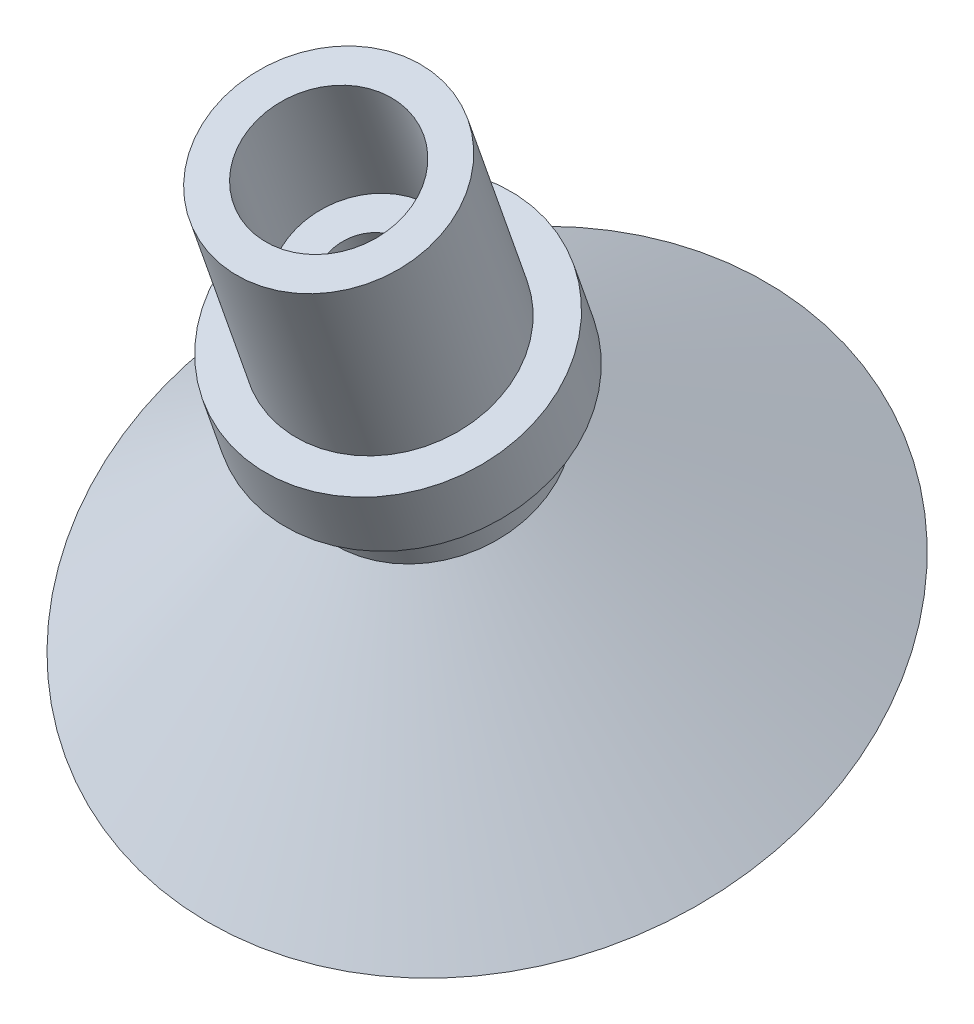
from build123d import *


with BuildPart() as part:
    # Inlet Fairlead Liner Profile → Inlet Fairlead Liner Feature (revolve)
    with BuildSketch(Plane(origin=(3.258206564, -5.512003586, 12.159792439), x_dir=(0.9714880974430896, 0.0978844603025642, -0.21593866943574935), z_dir=(0.2370883306415693, -0.40108928116054926, 0.8848256958360261)), mode=Mode.PRIVATE) as inlet_fairlead_liner_feature_sk:
        with BuildLine():
            Line((-23.152018399, -30.892753147), (-23.579443274, -34.869851081))
            Line((-23.579443274, -34.869851081), (-22.634882515, -34.971364489))
            Line((-22.634882515, -34.971364489), (-23.062307391, -38.948462423))
            add(Edge.make_bspline(
                [(-23.062307391, -38.948462423), (-23.13354487, -39.611312079), (-24.199056833, -40.167305516), (-24.270294312, -40.830155171)],
                knots=[0, 0, 0, 0, 1, 1, 1, 1], degree=3))
            ThreePointArc((-24.270294312, -40.830155171), (-26.470944377, -44.860719778), (-30.877078526, -46.154664759))
            Line((-30.877078526, -46.154664759), (-31.871353009, -46.04780854))
            Line((-31.871353009, -46.04780854), (-25.165141347, -40.733984574))
            Line((-25.165141347, -40.733984574), (-24.951428909, -38.745435607))
            Line((-24.951428909, -38.745435607), (-25.945703393, -38.638579389))
            Line((-25.945703393, -38.638579389), (-25.731990955, -36.650030422))
            Line((-25.731990955, -36.650030422), (-24.737716471, -36.75688664))
            Line((-24.737716471, -36.75688664), (-24.096579158, -30.79123974))
            Line((-24.096579158, -30.79123974), (-23.152018399, -30.892753147))
        make_face()
    revolve(inlet_fairlead_liner_feature_sk.sketch.rotate(Axis((-17.253555798, -35.915165888, 3.874224953), (-0.10380954475082989, -0.9160389667138149, -0.38742249532069234)), 283.790724011), axis=Axis((-17.253555798, -35.915165888, 3.874224953), (-0.10380954475082989, -0.9160389667138149, -0.38742249532069234)))


solid = part.part
